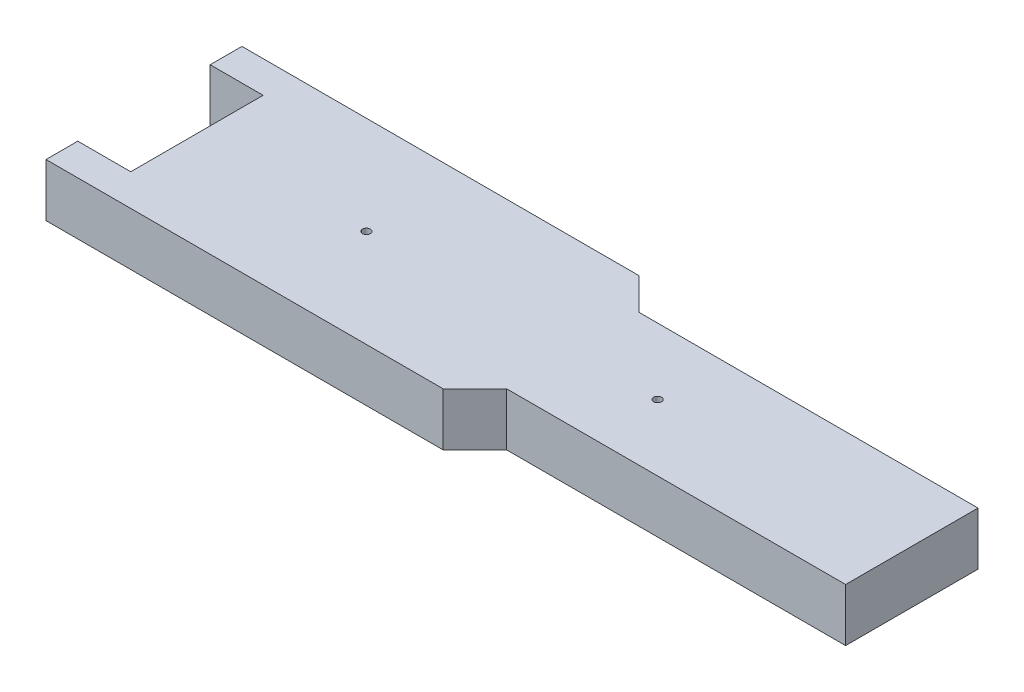
from build123d import *

# Parameters (mm, degrees)
EXTRUDE_1_DEPTH        = 10
SKETCH_2_R             = 0.75
CUT_EXTRUDE_1_DEPTH    = 149.613592918
PATTERN_LINEAR_1_COUNT = 2
PATTERN_LINEAR_1_PITCH = 55


with BuildPart() as part:
    # Эскиз1 → Бобышка-Вытянуть1 (new body)
    with BuildSketch(Plane(origin=(0, 0, 0), x_dir=(1, 0, 0), z_dir=(0, 1, 0))):
        Polygon((0, 31), (75, 31), (81, 25), (145, 25), (145, 0), (81, 0), (75, -6), (0, -6), (0, 0), (10, 0), (10, 25), (0, 25), align=None)
    extrude(amount=EXTRUDE_1_DEPTH)

    # Эскиз2 → Вырез-Вытянуть1 (cut, through all)
    with BuildSketch(Plane(origin=(0, 10, 0), x_dir=(1, 0, 0), z_dir=(0, 1, 0))):
        with Locations(Location((42, 12.5, 0), (0, 0, 270))):
            Circle(SKETCH_2_R)
    cut_extrude_1 = extrude(amount=-CUT_EXTRUDE_1_DEPTH, mode=Mode.SUBTRACT)

    # Линейный массив1: Вырез-Вытянуть1 ×2
    with Locations(*[(i * PATTERN_LINEAR_1_PITCH, 0, 0) for i in range(1, PATTERN_LINEAR_1_COUNT)]):
        add(cut_extrude_1, mode=Mode.SUBTRACT)


solid = part.part
